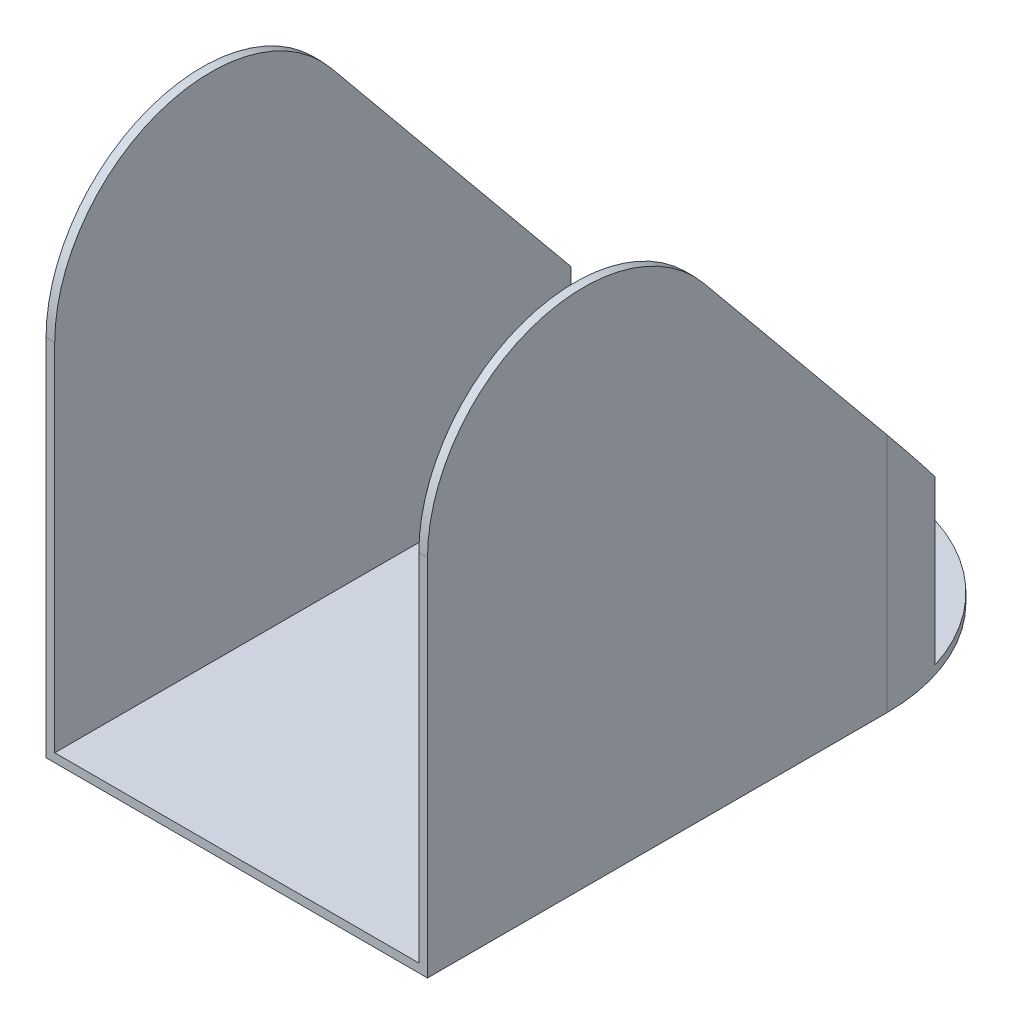
from build123d import *

# Parameters (mm, degrees)
EXTRUDE_1_DEPTH     = 75
CUT_EXTRUDE_1_REACH = 93.984
CUT_EXTRUDE_2_DEPTH = 99.534258002


with BuildPart() as part:
    # 草图1 → 凸台-拉伸1 (new body)
    with BuildSketch(Plane.XY):
        Polygon((21, 30), (21, -29), (-21, -29), (-21, 30), (-22, 30), (-22, -30), (22, -30), (22, 30), align=None)
    extrude(amount=EXTRUDE_1_DEPTH)

    # 切除-拉伸1: up to this face of the body (flat: up to its plane)
    cut_extrude_1_end = Plane(part.part.faces().sort_by_distance((-22, 0, 37.5))[0])
    # 草图2 → 切除-拉伸1 (cut, up to the picked face)
    with BuildSketch(Plane(origin=(22, 0, 0), x_dir=(0, 0, -1), z_dir=(1, 0, 0)), mode=Mode.PRIVATE) as cut_extrude_1_sk1:
        with BuildLine():
            Line((-43.094477021, 23.429629507), (0, -29))
            Line((0, -29), (0, 30))
            Line((0, 30), (-57, 30))
            ThreePointArc((-57, 30), (-49.310179818, 28.274724746), (-43.094477021, 23.429629507))
        make_face()
    cut_extrude_1_tool1 = split(extrude(cut_extrude_1_sk1.sketch, amount=-CUT_EXTRUDE_1_REACH, mode=Mode.PRIVATE), bisect_by=cut_extrude_1_end, keep=Keep.BOTH, mode=Mode.PRIVATE)
    # 草图2 → 切除-拉伸1 (cut, up to the picked face)
    with BuildSketch(Plane(origin=(22, 0, 0), x_dir=(0, 0, -1), z_dir=(1, 0, 0)), mode=Mode.PRIVATE) as cut_extrude_1_sk2:
        with BuildLine():
            ThreePointArc((-75, 12), (-69.727922061, 24.727922061), (-57, 30))
            Line((-57, 30), (-75, 30))
            Line((-75, 30), (-75, 12))
        make_face()
    cut_extrude_1_tool2 = split(extrude(cut_extrude_1_sk2.sketch, amount=-CUT_EXTRUDE_1_REACH, mode=Mode.PRIVATE), bisect_by=cut_extrude_1_end, keep=Keep.BOTH, mode=Mode.PRIVATE)
    add(cut_extrude_1_tool1.solids().sort_by(Axis((22, 10.461352, 16.395563), (-1, 0, 0)))[0], mode=Mode.SUBTRACT)
    add(cut_extrude_1_tool2.solids().sort_by(Axis((22, 25.979377, 70.979377), (-1, 0, 0)))[0], mode=Mode.SUBTRACT)

    # 草图3 → 切除-拉伸2 (cut, through all)
    with BuildSketch(Plane.XZ.offset(30)):
        with BuildLine():
            ThreePointArc((22, 22), (15.556349186, 6.443650814), (0, 0))
            Line((0, 0), (22, 0))
            Line((22, 0), (22, 22))
        make_face()
        with BuildLine():
            ThreePointArc((0, 0), (-15.556349186, 6.443650814), (-22, 22))
            Line((-22, 22), (-22, 0))
            Line((-22, 0), (0, 0))
        make_face()
    extrude(amount=-CUT_EXTRUDE_2_DEPTH, mode=Mode.SUBTRACT)


solid = part.part
